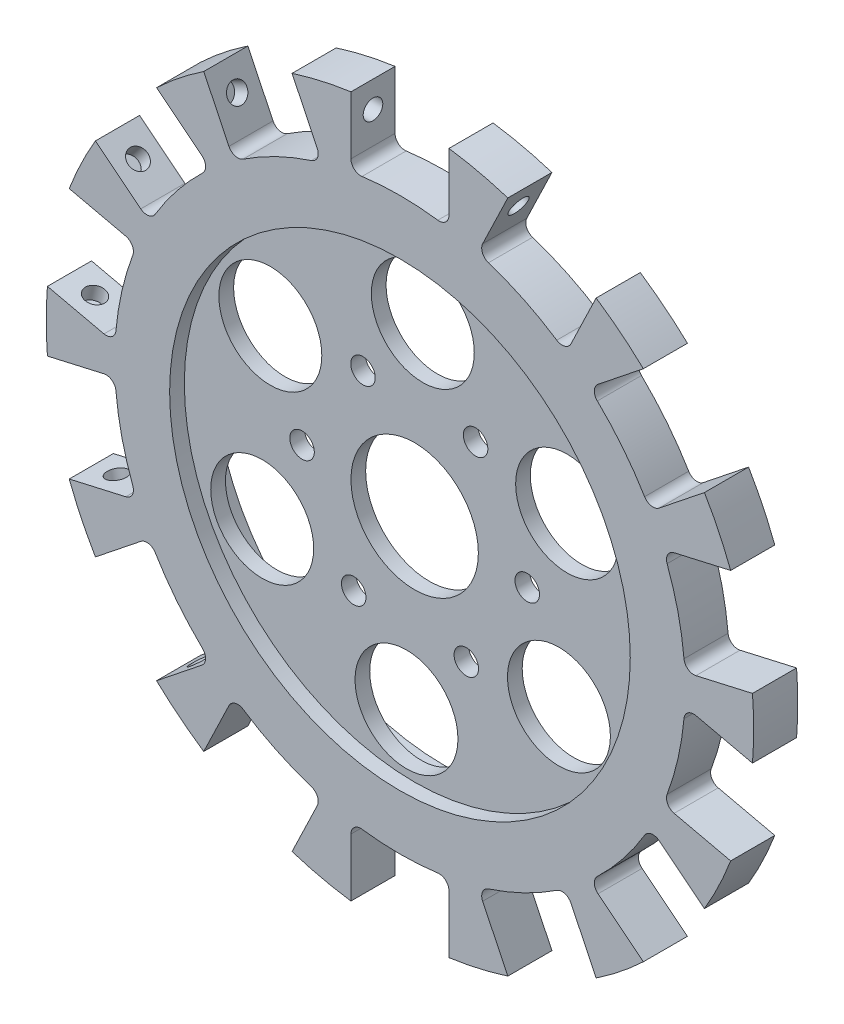
from build123d import *

# Parameters (mm, degrees)
SKETCH_1_R               = 72.2
EXTRUDE_1_DEPTH          = 9
CUT_EXTRUDE_START        = -9
CUT_EXTRUDE_2_DEPTH      = 9
SKETCH_3_R               = 47
CUT_EXTRUDE_3_DEPTH      = 3
CUT_EXTRUDE_START_2      = -3
SKETCH_4_R               = 47
CUT_EXTRUDE_4_DEPTH      = 3
SKETCH_6_R               = 2
CUT_EXTRUDE_6_DEPTH      = 3
SKETCH_5_R               = 13
SKETCH_5_R_2             = 2.5
SKETCH_5_R_3             = 10.5
CUT_EXTRUDE_7_DEPTH      = 102.792337629
PATTERN_CIRCULAR_1_COUNT = 14


with BuildPart() as part:
    # 草图1 → 凸台-拉伸1 (new body)
    with BuildSketch(Plane.XY):
        Circle(SKETCH_1_R)
    extrude(amount=EXTRUDE_1_DEPTH)

    # 草图2 → 切除-拉伸2 (cut)
    with BuildSketch(Plane.XY.offset(9).offset(CUT_EXTRUDE_START)):
        with BuildLine():
            Line((-10, 71.504125755), (-10, 59.666070761))
            ThreePointArc((-10, 59.666070761), (-9.316897592, 58.160819708), (-7.734219269, 57.683809273))
            ThreePointArc((-7.734219269, 57.683809273), (0, 58.2), (7.734219269, 57.683809273))
            ThreePointArc((7.734219269, 57.683809273), (9.316897592, 58.160819708), (10, 59.666070761))
            Line((10, 59.666070761), (10, 71.504125755))
            ThreePointArc((10, 71.504125755), (0, 72.2), (-10, 71.504125755))
        make_face()
        with BuildLine():
            Line((22.014788766, 68.761828623), (16.878449201, 58.096109616))
            ThreePointArc((16.878449201, 58.096109616), (16.840799249, 56.443538253), (18.059776075, 55.327068313))
            ThreePointArc((18.059776075, 55.327068313), (25.252033617, 52.436388112), (31.996357633, 48.615564362))
            ThreePointArc((31.996357633, 48.615564362), (33.629268601, 48.358637524), (34.897826559, 49.418434834))
            Line((34.897826559, 49.418434834), (40.034166124, 60.084153841))
            ThreePointArc((40.034166124, 60.084153841), (31.326405964, 65.049952263), (22.014788766, 68.761828623))
        make_face()
        with BuildLine():
            Line((49.669278623, 52.400408024), (40.413914537, 45.019501461))
            ThreePointArc((40.413914537, 45.019501461), (39.66296926, 43.546921812), (40.276811279, 42.012122931))
            ThreePointArc((40.276811279, 42.012122931), (45.50259228, 36.287106468), (49.921224958, 29.918410697))
            ThreePointArc((49.921224958, 29.918410697), (51.280950528, 28.978434099), (52.883710574, 29.382871811))
            Line((52.883710574, 29.382871811), (62.13907466, 36.763778374))
            ThreePointArc((62.13907466, 36.763778374), (56.448233034, 45.015963694), (49.669278623, 52.400408024))
        make_face()
        with BuildLine():
            Line((67.486158695, 25.660443967), (55.944908455, 23.026228913))
            ThreePointArc((55.944908455, 23.026228913), (54.629401775, 22.025303439), (54.516530046, 20.376161358))
            ThreePointArc((54.516530046, 20.376161358), (56.740804489, 12.950718356), (57.958581437, 5.295548869))
            ThreePointArc((57.958581437, 5.295548869), (58.775811283, 3.858696403), (60.395327134, 3.527670669))
            Line((60.395327134, 3.527670669), (71.936577374, 6.161885723))
            ThreePointArc((71.936577374, 6.161885723), (70.38979526, 16.066011432), (67.486158695, 25.660443967))
        make_face()
        with BuildLine():
            Line((71.936577374, -6.161885723), (60.395327134, -3.527670669))
            ThreePointArc((60.395327134, -3.527670669), (58.775811283, -3.858696403), (57.958581437, -5.295548869))
            ThreePointArc((57.958581437, -5.295548869), (56.740804489, -12.950718356), (54.516530046, -20.376161358))
            ThreePointArc((54.516530046, -20.376161358), (54.629401775, -22.025303439), (55.944908455, -23.026228913))
            Line((55.944908455, -23.026228913), (67.486158695, -25.660443967))
            ThreePointArc((67.486158695, -25.660443967), (70.38979526, -16.066011432), (71.936577374, -6.161885723))
        make_face()
        with BuildLine():
            Line((62.13907466, -36.763778374), (52.883710574, -29.382871811))
            ThreePointArc((52.883710574, -29.382871811), (51.280950528, -28.978434099), (49.921224958, -29.918410697))
            ThreePointArc((49.921224958, -29.918410697), (45.50259228, -36.287106468), (40.276811279, -42.012122931))
            ThreePointArc((40.276811279, -42.012122931), (39.66296926, -43.546921812), (40.413914537, -45.019501461))
            Line((40.413914537, -45.019501461), (49.669278623, -52.400408024))
            ThreePointArc((49.669278623, -52.400408024), (56.448233034, -45.015963694), (62.13907466, -36.763778374))
        make_face()
        with BuildLine():
            Line((40.034166124, -60.084153841), (34.897826559, -49.418434834))
            ThreePointArc((34.897826559, -49.418434834), (33.629268601, -48.358637524), (31.996357633, -48.615564362))
            ThreePointArc((31.996357633, -48.615564362), (25.252033617, -52.436388112), (18.059776075, -55.327068313))
            ThreePointArc((18.059776075, -55.327068313), (16.840799249, -56.443538253), (16.878449201, -58.096109616))
            Line((16.878449201, -58.096109616), (22.014788766, -68.761828623))
            ThreePointArc((22.014788766, -68.761828623), (31.326405964, -65.049952263), (40.034166124, -60.084153841))
        make_face()
        with BuildLine():
            Line((10, -71.504125755), (10, -59.666070761))
            ThreePointArc((10, -59.666070761), (9.316897592, -58.160819708), (7.734219269, -57.683809273))
            ThreePointArc((7.734219269, -57.683809273), (0, -58.2), (-7.734219269, -57.683809273))
            ThreePointArc((-7.734219269, -57.683809273), (-9.316897592, -58.160819708), (-10, -59.666070761))
            Line((-10, -59.666070761), (-10, -71.504125755))
            ThreePointArc((-10, -71.504125755), (0, -72.2), (10, -71.504125755))
        make_face()
        with BuildLine():
            Line((-22.014788766, -68.761828623), (-16.878449201, -58.096109616))
            ThreePointArc((-16.878449201, -58.096109616), (-16.840799249, -56.443538253), (-18.059776075, -55.327068313))
            ThreePointArc((-18.059776075, -55.327068313), (-25.252033617, -52.436388112), (-31.996357633, -48.615564362))
            ThreePointArc((-31.996357633, -48.615564362), (-33.629268601, -48.358637524), (-34.897826559, -49.418434834))
            Line((-34.897826559, -49.418434834), (-40.034166124, -60.084153841))
            ThreePointArc((-40.034166124, -60.084153841), (-31.326405964, -65.049952263), (-22.014788766, -68.761828623))
        make_face()
        with BuildLine():
            Line((-49.669278623, -52.400408024), (-40.413914537, -45.019501461))
            ThreePointArc((-40.413914537, -45.019501461), (-39.66296926, -43.546921812), (-40.276811279, -42.012122931))
            ThreePointArc((-40.276811279, -42.012122931), (-45.50259228, -36.287106468), (-49.921224958, -29.918410697))
            ThreePointArc((-49.921224958, -29.918410697), (-51.280950528, -28.978434099), (-52.883710574, -29.382871811))
            Line((-52.883710574, -29.382871811), (-62.13907466, -36.763778374))
            ThreePointArc((-62.13907466, -36.763778374), (-56.448233034, -45.015963694), (-49.669278623, -52.400408024))
        make_face()
        with BuildLine():
            Line((-67.486158695, -25.660443967), (-55.944908455, -23.026228913))
            ThreePointArc((-55.944908455, -23.026228913), (-54.629401775, -22.025303439), (-54.516530046, -20.376161358))
            ThreePointArc((-54.516530046, -20.376161358), (-56.740804489, -12.950718356), (-57.958581437, -5.295548869))
            ThreePointArc((-57.958581437, -5.295548869), (-58.775811283, -3.858696403), (-60.395327134, -3.527670669))
            Line((-60.395327134, -3.527670669), (-71.936577374, -6.161885723))
            ThreePointArc((-71.936577374, -6.161885723), (-70.38979526, -16.066011432), (-67.486158695, -25.660443967))
        make_face()
        with BuildLine():
            Line((-71.936577374, 6.161885723), (-60.395327134, 3.527670669))
            ThreePointArc((-60.395327134, 3.527670669), (-58.775811283, 3.858696403), (-57.958581437, 5.295548869))
            ThreePointArc((-57.958581437, 5.295548869), (-56.740804489, 12.950718356), (-54.516530046, 20.376161358))
            ThreePointArc((-54.516530046, 20.376161358), (-54.629401775, 22.025303439), (-55.944908455, 23.026228913))
            Line((-55.944908455, 23.026228913), (-67.486158695, 25.660443967))
            ThreePointArc((-67.486158695, 25.660443967), (-70.38979526, 16.066011432), (-71.936577374, 6.161885723))
        make_face()
        with BuildLine():
            Line((-62.13907466, 36.763778374), (-52.883710574, 29.382871811))
            ThreePointArc((-52.883710574, 29.382871811), (-51.280950528, 28.978434099), (-49.921224958, 29.918410697))
            ThreePointArc((-49.921224958, 29.918410697), (-45.50259228, 36.287106468), (-40.276811279, 42.012122931))
            ThreePointArc((-40.276811279, 42.012122931), (-39.66296926, 43.546921812), (-40.413914537, 45.019501461))
            Line((-40.413914537, 45.019501461), (-49.669278623, 52.400408024))
            ThreePointArc((-49.669278623, 52.400408024), (-56.448233034, 45.015963694), (-62.13907466, 36.763778374))
        make_face()
        with BuildLine():
            Line((-40.034166124, 60.084153841), (-34.897826559, 49.418434834))
            ThreePointArc((-34.897826559, 49.418434834), (-33.629268601, 48.358637524), (-31.996357633, 48.615564362))
            ThreePointArc((-31.996357633, 48.615564362), (-25.252033617, 52.436388112), (-18.059776075, 55.327068313))
            ThreePointArc((-18.059776075, 55.327068313), (-16.840799249, 56.443538253), (-16.878449201, 58.096109616))
            Line((-16.878449201, 58.096109616), (-22.014788766, 68.761828623))
            ThreePointArc((-22.014788766, 68.761828623), (-31.326405964, 65.049952263), (-40.034166124, 60.084153841))
        make_face()
    extrude(amount=CUT_EXTRUDE_2_DEPTH, mode=Mode.SUBTRACT)

    # 草图3 → 切除-拉伸3 (cut)
    with BuildSketch(Plane.XY.offset(9)):
        Circle(SKETCH_3_R)
    extrude(amount=-CUT_EXTRUDE_3_DEPTH, mode=Mode.SUBTRACT)

    # 草图4 → 切除-拉伸4 (cut)
    with BuildSketch(Plane(origin=(0, 0, 0), x_dir=(-1, 0, 0), z_dir=(0, 0, -1)).offset(CUT_EXTRUDE_START_2)):
        Circle(SKETCH_4_R)
    extrude(amount=CUT_EXTRUDE_4_DEPTH, mode=Mode.SUBTRACT)

    # 草图6 → 切除-拉伸6 (cut)
    with BuildSketch(Plane(origin=(-10, 0, 0), x_dir=(0, 0, -1), z_dir=(1, 0, 0))):
        with Locations((-4.5, 66.154125755)):
            Circle(SKETCH_6_R)
    cut_extrude_6 = extrude(amount=-CUT_EXTRUDE_6_DEPTH, mode=Mode.SUBTRACT)

    # 草图5 → 切除-拉伸7 (cut, through all)
    with BuildSketch(Plane(origin=(0, 0, 3), x_dir=(-1, 0, 0), z_dir=(0, 0, -1))):
        Circle(SKETCH_5_R)
        with Locations((-12.434738801, 19.348831255)):
            Circle(SKETCH_5_R_2)
        with Locations((10.53921, 20.443215319)):
            Circle(SKETCH_5_R_2)
        with Locations((29.443873649, 18.922428611)):
            Circle(SKETCH_5_R_3)
        with Locations((22.973948801, 1.094384064)):
            Circle(SKETCH_5_R_2)
        with Locations((31.109240703, -16.03792826)):
            Circle(SKETCH_5_R_3)
        with Locations((12.434738801, -19.348831255)):
            Circle(SKETCH_5_R_2)
        with Locations((-1.665367054, 34.960356871)):
            Circle(SKETCH_5_R_3)
        with Locations((1.665367054, -34.960356871)):
            Circle(SKETCH_5_R_3)
        with Locations((-10.53921, -20.443215319)):
            Circle(SKETCH_5_R_2)
        with Locations((-29.443873649, -18.922428611)):
            Circle(SKETCH_5_R_3)
        with Locations((-22.973948801, -1.094384064)):
            Circle(SKETCH_5_R_2)
        with Locations((-31.109240703, 16.03792826)):
            Circle(SKETCH_5_R_3)
    extrude(amount=-CUT_EXTRUDE_7_DEPTH, mode=Mode.SUBTRACT)

    # 阵列(圆周)1: 切除-拉伸6 ×14 about axis
    pattern_circular_1_axis = Axis((0, 0, 9), (0, 0, -1))
    for i in range(1, PATTERN_CIRCULAR_1_COUNT):
        add(cut_extrude_6.rotate(pattern_circular_1_axis, i * 360 / PATTERN_CIRCULAR_1_COUNT), mode=Mode.SUBTRACT)


solid = part.part
